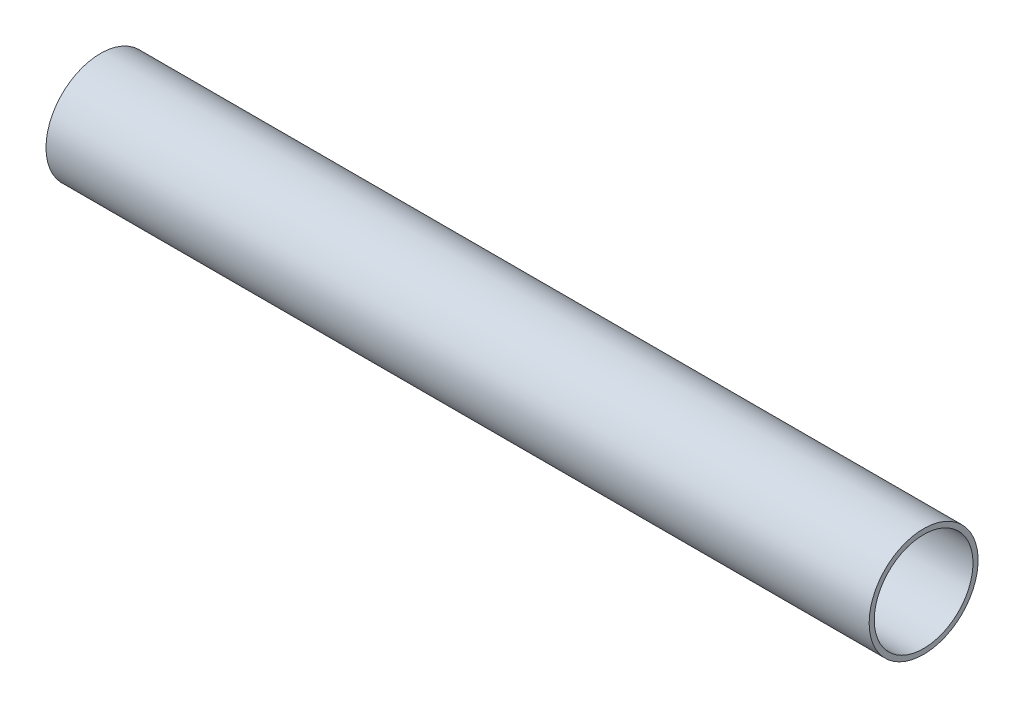
from build123d import *

# Parameters (mm, degrees)
SKETCH1_W = 225.11
SKETCH1_H = 1.4


with BuildPart() as part:
    # Sketch1 → Revolve1 (revolve)
    with BuildSketch(Plane.XY, mode=Mode.PRIVATE) as revolve1_sk:
        with Locations((112.555, 14.2)):
            Rectangle(SKETCH1_W, SKETCH1_H)
    revolve(revolve1_sk.sketch.rotate(Axis((0, 0, 0), (1, 0, 0)), 90), axis=Axis((0, 0, 0), (1, 0, 0)))


solid = part.part
